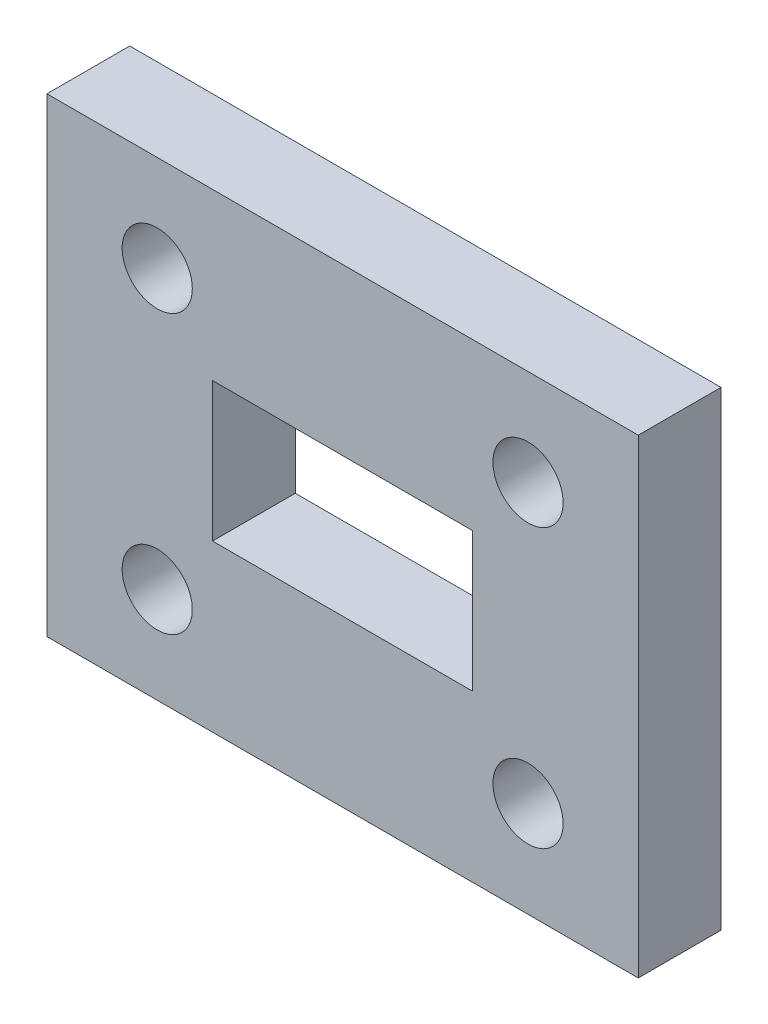
from build123d import *

# Parameters (mm, degrees)
SKETCH2_W           = 22.6822
SKETCH2_H           = 18.034
SKETCH2_R           = 1.3462
SKETCH2_W_2         = 9.9822
SKETCH2_H_2         = 5.334
BOSS_EXTRUDE1_DEPTH = 3.175


with BuildPart() as part:
    # Sketch2 → Boss-Extrude1 (new body)
    with BuildSketch(Plane.XY):
        Rectangle(SKETCH2_W, SKETCH2_H)
        with Locations((-7.112, 5.334)):
            Circle(SKETCH2_R, mode=Mode.SUBTRACT)
        with Locations(Location((7.112, 5.334, 0), (0, 0, 180))):
            Circle(SKETCH2_R, mode=Mode.SUBTRACT)
        with Locations((7.112, -5.334)):
            Circle(SKETCH2_R, mode=Mode.SUBTRACT)
        with Locations(Location((-7.112, -5.334, 0), (0, 0, 180))):
            Circle(SKETCH2_R, mode=Mode.SUBTRACT)
        Rectangle(SKETCH2_W_2, SKETCH2_H_2, mode=Mode.SUBTRACT)
    extrude(amount=BOSS_EXTRUDE1_DEPTH)


solid = part.part
